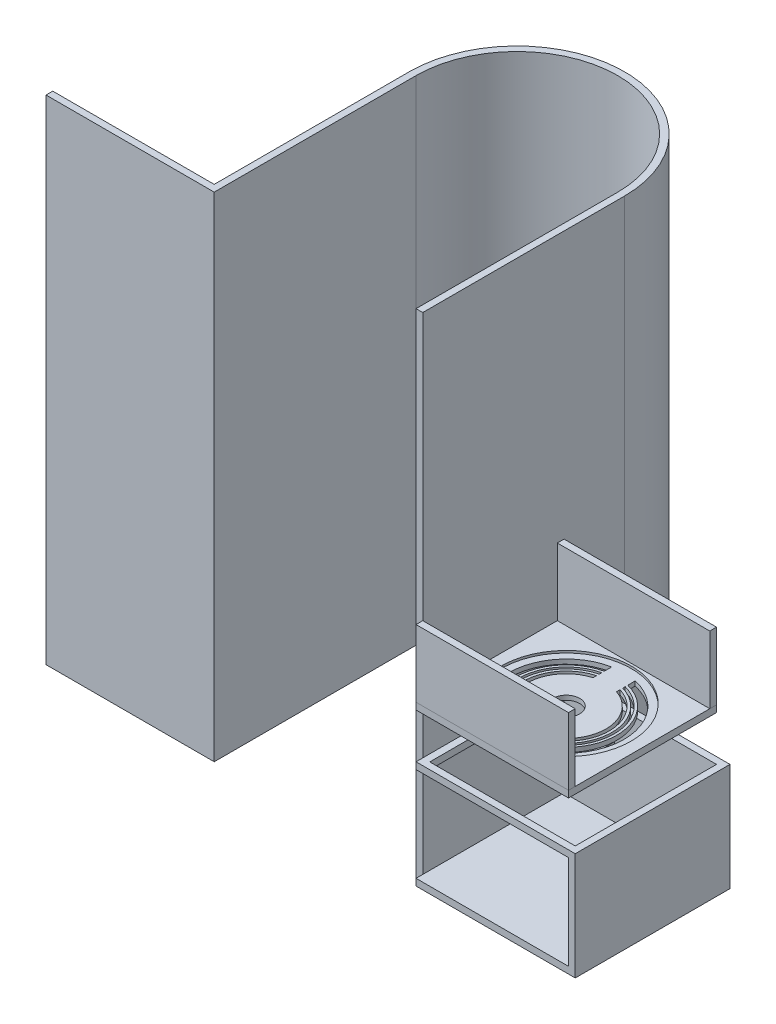
from build123d import *

# Parameters (mm, degrees)
EXTRUDE_1_DEPTH     = 220
SKETCH_2_W          = 68
SKETCH_2_H          = 3
EXTRUDE_2_DEPTH     = 60
SKETCH_3_R          = 6
CUT_EXTRUDE_2_DEPTH = 10
SKETCH_4_W          = 14.991340548
SKETCH_4_H          = 5.314075951
EXTRUDE_2_2_DEPTH   = 15
SKETCH_7_W          = 14.991340548
SKETCH_7_H          = 3
EXTRUDE_3_DEPTH     = 28
SKETCH_9_R          = 29
CUT_EXTRUDE_3_DEPTH = 1
SKETCH_12_W         = 68
SKETCH_12_H         = 3
EXTRUDE_5_DEPTH     = 3
EXTRUDE_8_DEPTH     = 30
SKETCH_15_W         = 68
SKETCH_15_H         = 3
EXTRUDE_9_DEPTH     = 3
SKETCH_16_W         = 68
SKETCH_16_H         = 3
EXTRUDE_10_DEPTH    = 30
SKETCH_17_R         = 4.99636976
CUT_EXTRUDE_6_DEPTH = 30
SKETCH_24_W         = 68
SKETCH_24_H         = 66
EXTRUDE_14_DEPTH    = 3
EXTRUDE_15_DEPTH    = 45
SKETCH_28_W         = 71
SKETCH_28_H         = 69
SKETCH_28_W_2       = 64.892616755
SKETCH_28_H_2       = 63
EXTRUDE_16_DEPTH    = 3


with BuildPart() as part:
    # 草图1 → 拉伸-薄壁1 (new body)
    with BuildSketch(Plane(origin=(0, 0, 0), x_dir=(1, 0, 0), z_dir=(0, 1, 0))):
        with BuildLine():
            Line((0, 0), (75, 0))
            Line((75, 0), (75, 90))
            ThreePointArc((75, 90), (120, 135), (165, 90))
            Line((165, 90), (165, 0))
            Line((165, 0), (168, 0))
            Line((168, 0), (168, 90))
            ThreePointArc((168, 90), (120, 138), (72, 90))
            Line((72, 90), (72, 3))
            Line((72, 3), (0, 3))
            Line((0, 3), (0, 0))
        make_face()
    extrude(amount=EXTRUDE_1_DEPTH)

    # 草图2 → Extrude 2 (add)
    with BuildSketch(Plane.XY):
        with Locations((202, 69.5)):
            Rectangle(SKETCH_2_W, SKETCH_2_H)
    extrude(amount=-EXTRUDE_2_DEPTH)

    # 草图3 → 切除-拉伸2 (cut)
    with BuildSketch(Plane(origin=(0, 71, 0), x_dir=(1, 0, 0), z_dir=(0, 1, 0))):
        with Locations(Location((202, 30, 0), (0, 0, 270))):
            Circle(SKETCH_3_R)
    extrude(amount=-CUT_EXTRUDE_2_DEPTH, mode=Mode.SUBTRACT)

    # 草图4 → Extrude 2 2 (add)
    with BuildSketch(Plane(origin=(0, 68, 0), x_dir=(-1, 0, 0), z_dir=(0, -1, 0))):
        with Locations((-202, 18.657720536)):
            Rectangle(SKETCH_4_W, SKETCH_4_H)
    extrude(amount=EXTRUDE_2_2_DEPTH)

    # 草图7 → 凸台-拉伸3 (add)
    with BuildSketch(Plane.XY.offset(-16.00068256)):
        with Locations((202, 51.5)):
            Rectangle(SKETCH_7_W, SKETCH_7_H)
    extrude(amount=-EXTRUDE_3_DEPTH)

    # 草图9 → 切除-拉伸3 (cut)
    with BuildSketch(Plane(origin=(0, 71, 0), x_dir=(1, 0, 0), z_dir=(0, 1, 0))):
        with Locations(Location((202, 30, 0), (0, 0, 270))):
            Circle(SKETCH_9_R)
    extrude(amount=-CUT_EXTRUDE_3_DEPTH, mode=Mode.SUBTRACT)

    # 草图12 → 凸台-拉伸5 (add)
    with BuildSketch(Plane.XY):
        with Locations((202, 69.5)):
            Rectangle(SKETCH_12_W, SKETCH_12_H)
    extrude(amount=EXTRUDE_5_DEPTH)

    # 草图15 → 凸台-拉伸9 (add)
    with BuildSketch(Plane(origin=(0, 0, -60), x_dir=(-1, 0, 0), z_dir=(0, 0, -1))):
        with Locations((-202, 69.5)):
            Rectangle(SKETCH_15_W, SKETCH_15_H)
    extrude(amount=EXTRUDE_9_DEPTH)

    # 草图17 → 切除-拉伸6 (cut)
    with BuildSketch(Plane(origin=(0, 71, 0), x_dir=(1, 0, 0), z_dir=(0, 1, 0))):
        with Locations(Location((202, 30, 0), (0, 0, 270))):
            Circle(SKETCH_17_R)
        with BuildLine():
            Line((197.00363024, 55.253950311), (197.00363024, 51.949118376))
            ThreePointArc((197.00363024, 51.949118376), (201.672799014, 7.491769332), (207.632270084, 51.794610388))
            Line((207.632270084, 51.794610388), (207.632270084, 55.11977808))
            ThreePointArc((207.632270084, 55.11977808), (201.675049462, 4.258591254), (197.00363024, 55.253950311))
        make_face()
        with BuildLine():
            Line((197.00363024, 49.700946475), (197.00363024, 50.820061064))
            ThreePointArc((197.00363024, 50.820061064), (201.671776631, 8.591335331), (207.632270084, 50.657109846))
            Line((207.632270084, 50.657109846), (207.632270084, 49.528659362))
            ThreePointArc((207.632270084, 49.528659362), (201.670586859, 9.678029383), (197.00363024, 49.700946475))
        make_face()
        with BuildLine():
            Line((197.00363024, 46.943607575), (197.00363024, 48.517967978))
            ThreePointArc((197.00363024, 48.517967978), (201.66909035, 10.822686642), (207.632270084, 48.334567966))
            Line((207.632270084, 48.334567966), (207.632270084, 46.742971126))
            ThreePointArc((207.632270084, 46.742971126), (201.666599263, 12.338222276), (197.00363024, 46.943607575))
        make_face()
    extrude(amount=-CUT_EXTRUDE_6_DEPTH, mode=Mode.SUBTRACT)

    # 草图24 → 凸台-拉伸14 (add)
    with BuildSketch(Plane(origin=(0, 0, 0), x_dir=(1, 0, 0), z_dir=(0, 1, 0))):
        with Locations((202, 30)):
            Rectangle(SKETCH_24_W, SKETCH_24_H)
    extrude(amount=EXTRUDE_14_DEPTH)

    # 草图25 → 凸台-拉伸15 (add)
    with BuildSketch(Plane(origin=(0, 0, 0), x_dir=(1, 0, 0), z_dir=(0, 1, 0))):
        Polygon((168, 63), (168, 66), (236, 66), (239, 66), (239, -3), (236, -3), (236, 63), align=None)
    extrude(amount=EXTRUDE_15_DEPTH)

    # 草图28 → 凸台-拉伸16 (add)
    with BuildSketch(Plane(origin=(0, 45, 0), x_dir=(1, 0, 0), z_dir=(0, 1, 0))):
        with Locations((203.5, 31.5)):
            Rectangle(SKETCH_28_W, SKETCH_28_H)
        with Locations((203.553691623, 31.5)):
            Rectangle(SKETCH_28_W_2, SKETCH_28_H_2, mode=Mode.SUBTRACT)
    extrude(amount=EXTRUDE_16_DEPTH)


with BuildPart() as body_2:
    # 草图13 → 凸台-拉伸8 (new body)
    with BuildSketch(Plane(origin=(0, 71, 0), x_dir=(1, 0, 0), z_dir=(0, 1, 0))):
        Polygon((167.996083908, 0), (168, -3), (236, -3), (236, 0), align=None)
    extrude(amount=EXTRUDE_8_DEPTH)


with BuildPart() as body_3:
    # 草图16 → 凸台-拉伸10 (new body)
    with BuildSketch(Plane(origin=(0, 71, 0), x_dir=(1, 0, 0), z_dir=(0, 1, 0))):
        with Locations((202, 61.5)):
            Rectangle(SKETCH_16_W, SKETCH_16_H)
    extrude(amount=EXTRUDE_10_DEPTH)


solid = Compound([part.part, body_2.part, body_3.part])
